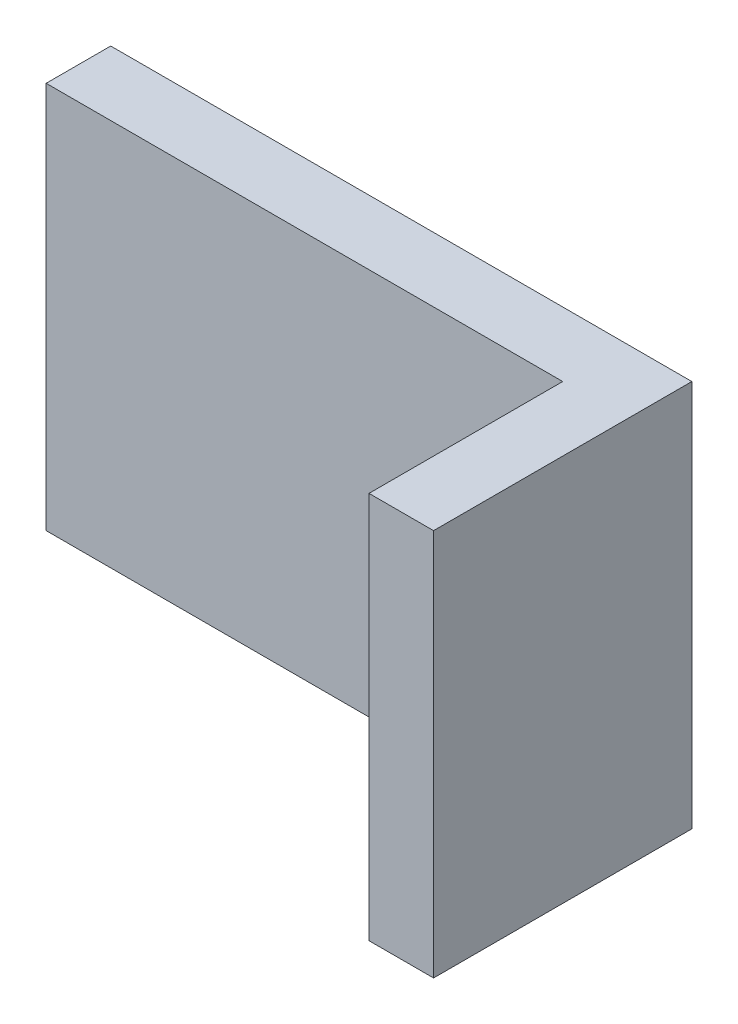
from build123d import *

# Parameters (mm, degrees)
SKETCH2_W           = 4000
SKETCH2_H           = 3000
BOSS_EXTRUDE1_DEPTH = 500
SKETCH3_W           = 2000
SKETCH3_H           = 3000
BOSS_EXTRUDE2_DEPTH = 500


with BuildPart() as part:
    # Sketch2 → Boss-Extrude1 (new body)
    with BuildSketch(Plane.XY):
        with Locations((2000, 1500)):
            Rectangle(SKETCH2_W, SKETCH2_H)
    extrude(amount=BOSS_EXTRUDE1_DEPTH)

    # Sketch3 → Boss-Extrude2 (add)
    with BuildSketch(Plane(origin=(4000, 0, 0), x_dir=(0, 0, -1), z_dir=(1, 0, 0))):
        with Locations((-1000, 1500)):
            Rectangle(SKETCH3_W, SKETCH3_H)
    extrude(amount=BOSS_EXTRUDE2_DEPTH)


solid = part.part
